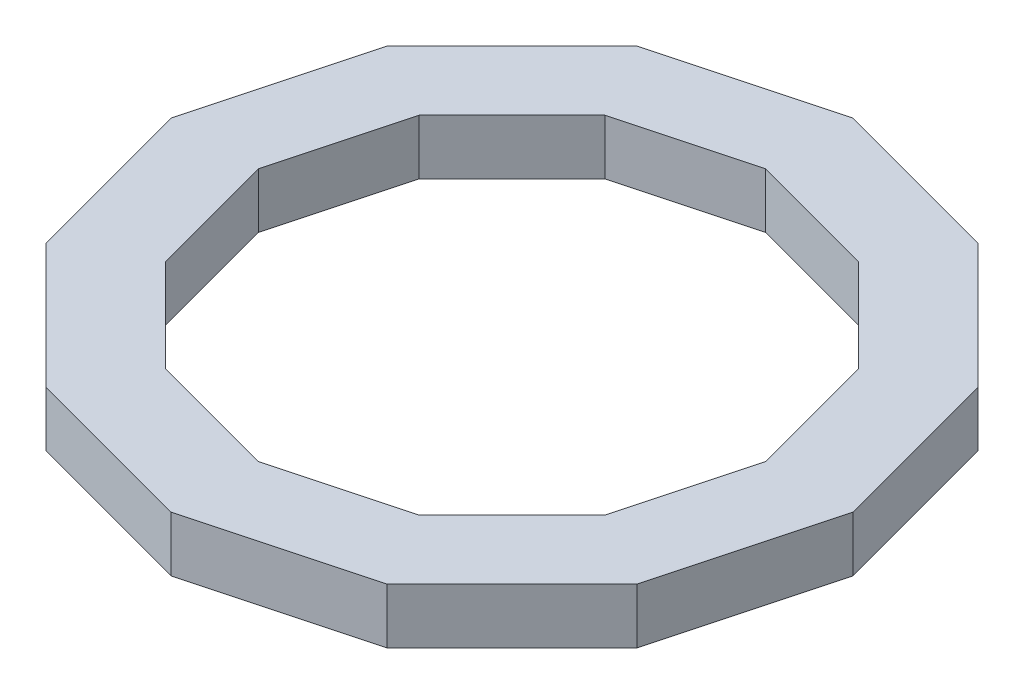
from build123d import *

# Parameters (mm, degrees)
BOSS_EXTRUDE1_DEPTH = 19.05


with BuildPart() as part:
    # Sketch1 → Boss-Extrude1 (new body)
    with BuildSketch(Plane(origin=(0, 0, 0), x_dir=(1, 0, 0), z_dir=(0, 1, 0))):
        Polygon((117.765676741, 0), (101.988067752, 58.882838371), (58.882838371, 101.988067752), (0, 117.765676741), (-58.882838371, 101.988067752), (-101.988067752, 58.882838371), (-117.765676741, 0), (-101.988067752, -58.882838371), (-58.882838371, -101.988067752), (0, -117.765676741), (58.882838371, -101.988067752), (101.988067752, -58.882838371), align=None)
        Polygon((87.525259511, 0), (75.79909821, 43.762629756), (43.762629756, 75.79909821), (0, 87.525259511), (-43.762629756, 75.79909821), (-75.79909821, 43.762629756), (-87.525259511, 0), (-75.79909821, -43.762629756), (-43.762629756, -75.79909821), (0, -87.525259511), (43.762629756, -75.79909821), (75.79909821, -43.762629756), align=None, mode=Mode.SUBTRACT)
    extrude(amount=BOSS_EXTRUDE1_DEPTH)


solid = part.part
